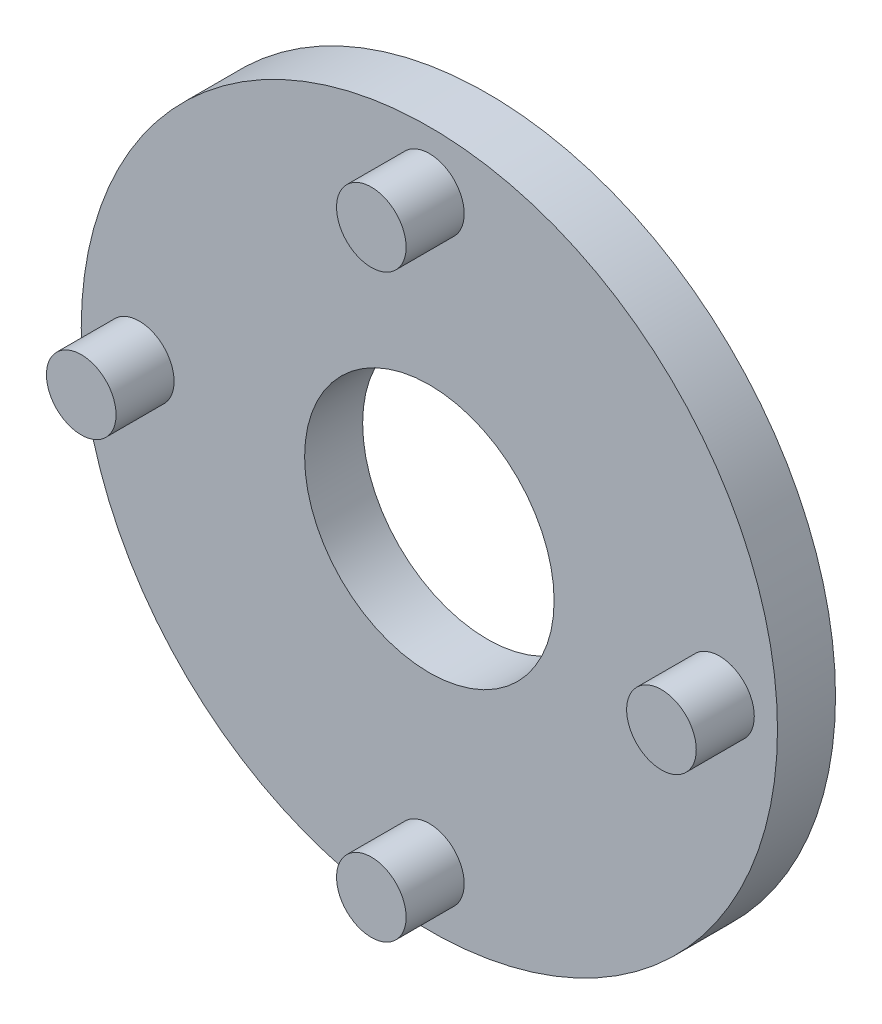
from build123d import *

# Parameters (mm, degrees)
SKETCH_1_R          = 3
EXTRUDE_1_DEPTH     = 5
EXTRUDE_1_2_DEPTH   = 5
EXTRUDE_1_3_DEPTH   = 5
EXTRUDE_1_4_DEPTH   = 5
SKETCH_2_R          = 30
EXTRUDE_2_DEPTH     = 5
SKETCH_3_R          = 10.75
CUT_EXTRUDE_1_DEPTH = 5
SKETCH_4_R          = 17
SKETCH_4_R_2        = 15
CUT_EXTRUDE_3_DEPTH = 3


with BuildPart() as part:
    # 草图1 → 凸台-拉伸1 (new body)
    with BuildSketch(Plane.XY):
        with Locations((25, 0)):
            Circle(SKETCH_1_R)
    extrude(amount=-EXTRUDE_1_DEPTH)



with BuildPart() as body_2:
    # 草图1 → Extrude 1 2 (new body)
    with BuildSketch(Plane.XY):
        with Locations((0, -25)):
            Circle(SKETCH_1_R)
    extrude(amount=-EXTRUDE_1_2_DEPTH)


with BuildPart() as body_3:
    # 草图1 → Extrude 1 3 (new body)
    with BuildSketch(Plane.XY):
        with Locations((-25, 0)):
            Circle(SKETCH_1_R)
    extrude(amount=-EXTRUDE_1_3_DEPTH)


with BuildPart() as body_4:
    # 草图1 → Extrude 1 4 (new body)
    with BuildSketch(Plane.XY):
        with Locations((0, 25)):
            Circle(SKETCH_1_R)
    extrude(amount=-EXTRUDE_1_4_DEPTH)


with BuildPart() as part_1:
    add(part.part)

    add(body_2.part)  # 凸台-拉伸2 merges body 2

    add(body_3.part)  # 凸台-拉伸2 merges body 3

    add(body_4.part)  # 凸台-拉伸2 merges body 4
    # 草图2 → 凸台-拉伸2 (add)
    with BuildSketch(Plane(origin=(0, 0, -5), x_dir=(-1, 0, 0), z_dir=(0, 0, -1))):
        with Locations(Location((0, 0, 0), (0, 0, 180))):
            Circle(SKETCH_2_R)
    extrude(amount=EXTRUDE_2_DEPTH)

    # 草图3 → 切除-拉伸1 (cut)
    with BuildSketch(Plane(origin=(0, 0, -10), x_dir=(-1, 0, 0), z_dir=(0, 0, -1))):
        Circle(SKETCH_3_R)
    extrude(amount=-CUT_EXTRUDE_1_DEPTH, mode=Mode.SUBTRACT)

    # 草图4 → 切除-拉伸3 (cut)
    with BuildSketch(Plane(origin=(0, 0, -10), x_dir=(-1, 0, 0), z_dir=(0, 0, -1))):
        Circle(SKETCH_4_R)
        Circle(SKETCH_4_R_2, mode=Mode.SUBTRACT)
    extrude(amount=-CUT_EXTRUDE_3_DEPTH, mode=Mode.SUBTRACT)


solid = part_1.part
